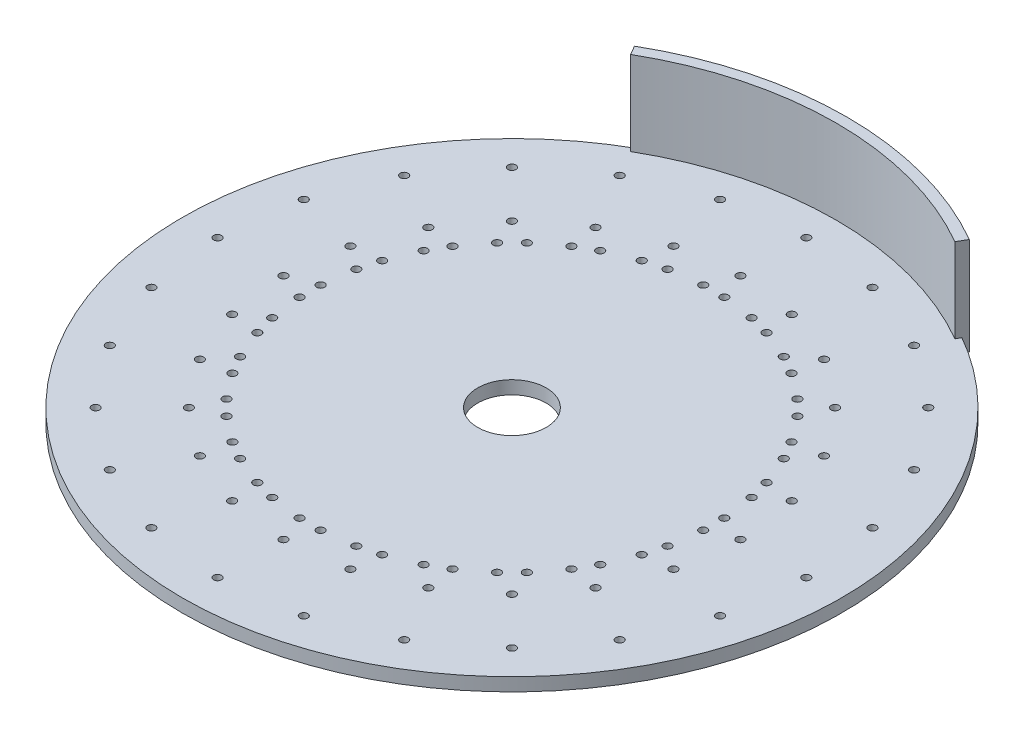
from build123d import *

# Parameters (mm, degrees)
SKETCH1_R                = 125
SKETCH1_R_2              = 1.5
SKETCH1_R_3              = 13
BOSS_EXTRUDE1_DEPTH      = 2.5
BOSS_EXTRUDE2_DEPTH      = 32
BOSS_EXTRUDE2_DEPTH_BACK = 5
BOSS_EXTRUDE3_START      = 32
BOSS_EXTRUDE3_DEPTH      = 31.9


with BuildPart() as part:
    # Sketch1 → Boss-Extrude1 (new, symmetric)
    with BuildSketch(Plane(origin=(0, 0, 0), x_dir=(1, 0, 0), z_dir=(0, 1, 0))):
        with Locations(Location((0, 0, 0), (0, 0, 270))):
            Circle(SKETCH1_R)
        with Locations(Location((-4, 76.547549861, 0), (0, 0, 270))):
            Circle(SKETCH1_R_2, mode=Mode.SUBTRACT)
        with Locations(Location((4, 76.547549861, 0), (0, 0, 90))):
            Circle(SKETCH1_R_2, mode=Mode.SUBTRACT)
        with Locations(Location((15.948260455, 74.97453153, 0), (0, 0, 270))):
            Circle(SKETCH1_R_2, mode=Mode.SUBTRACT)
        with Locations(Location((23.675667065, 72.903979169, 0), (0, 0, 90))):
            Circle(SKETCH1_R_2, mode=Mode.SUBTRACT)
        with Locations(Location((34.809673315, 68.292122777, 0), (0, 0, 270))):
            Circle(SKETCH1_R_2, mode=Mode.SUBTRACT)
        with Locations(Location((41.737876545, 64.292122777, 0), (0, 0, 90))):
            Circle(SKETCH1_R_2, mode=Mode.SUBTRACT)
        with Locations(Location((51.298864465, 56.955718714, 0), (0, 0, 270))):
            Circle(SKETCH1_R_2, mode=Mode.SUBTRACT)
        with Locations(Location((56.955718714, 51.298864465, 0), (0, 0, 90))):
            Circle(SKETCH1_R_2, mode=Mode.SUBTRACT)
        with Locations(Location((64.292122777, 41.737876545, 0), (0, 0, 270))):
            Circle(SKETCH1_R_2, mode=Mode.SUBTRACT)
        with Locations(Location((68.292122777, 34.809673315, 0), (0, 0, 90))):
            Circle(SKETCH1_R_2, mode=Mode.SUBTRACT)
        with Locations(Location((72.903979169, 23.675667065, 0), (0, 0, 270))):
            Circle(SKETCH1_R_2, mode=Mode.SUBTRACT)
        with Locations(Location((74.97453153, 15.948260455, 0), (0, 0, 90))):
            Circle(SKETCH1_R_2, mode=Mode.SUBTRACT)
        with Locations(Location((76.547549861, 4, 0), (0, 0, 270))):
            Circle(SKETCH1_R_2, mode=Mode.SUBTRACT)
        with Locations(Location((76.547549861, -4, 0), (0, 0, 90))):
            Circle(SKETCH1_R_2, mode=Mode.SUBTRACT)
        with Locations(Location((74.97453153, -15.948260455, 0), (0, 0, 270))):
            Circle(SKETCH1_R_2, mode=Mode.SUBTRACT)
        with Locations(Location((72.903979169, -23.675667065, 0), (0, 0, 90))):
            Circle(SKETCH1_R_2, mode=Mode.SUBTRACT)
        with Locations(Location((68.292122777, -34.809673315, 0), (0, 0, 270))):
            Circle(SKETCH1_R_2, mode=Mode.SUBTRACT)
        with Locations(Location((64.292122777, -41.737876545, 0), (0, 0, 90))):
            Circle(SKETCH1_R_2, mode=Mode.SUBTRACT)
        with Locations(Location((56.955718714, -51.298864465, 0), (0, 0, 270))):
            Circle(SKETCH1_R_2, mode=Mode.SUBTRACT)
        with Locations(Location((51.298864465, -56.955718714, 0), (0, 0, 90))):
            Circle(SKETCH1_R_2, mode=Mode.SUBTRACT)
        with Locations(Location((41.737876545, -64.292122777, 0), (0, 0, 270))):
            Circle(SKETCH1_R_2, mode=Mode.SUBTRACT)
        with Locations(Location((34.809673315, -68.292122777, 0), (0, 0, 90))):
            Circle(SKETCH1_R_2, mode=Mode.SUBTRACT)
        with Locations(Location((23.675667065, -72.903979169, 0), (0, 0, 270))):
            Circle(SKETCH1_R_2, mode=Mode.SUBTRACT)
        with Locations(Location((15.948260455, -74.97453153, 0), (0, 0, 90))):
            Circle(SKETCH1_R_2, mode=Mode.SUBTRACT)
        with Locations(Location((4, -76.547549861, 0), (0, 0, 270))):
            Circle(SKETCH1_R_2, mode=Mode.SUBTRACT)
        with Locations(Location((-4, -76.547549861, 0), (0, 0, 90))):
            Circle(SKETCH1_R_2, mode=Mode.SUBTRACT)
        with Locations(Location((-15.948260455, -74.97453153, 0), (0, 0, 270))):
            Circle(SKETCH1_R_2, mode=Mode.SUBTRACT)
        with Locations(Location((-23.675667065, -72.903979169, 0), (0, 0, 90))):
            Circle(SKETCH1_R_2, mode=Mode.SUBTRACT)
        with Locations(Location((-34.809673315, -68.292122777, 0), (0, 0, 270))):
            Circle(SKETCH1_R_2, mode=Mode.SUBTRACT)
        with Locations(Location((-41.737876545, -64.292122777, 0), (0, 0, 90))):
            Circle(SKETCH1_R_2, mode=Mode.SUBTRACT)
        with Locations(Location((-51.298864465, -56.955718714, 0), (0, 0, 270))):
            Circle(SKETCH1_R_2, mode=Mode.SUBTRACT)
        with Locations(Location((-56.955718714, -51.298864465, 0), (0, 0, 90))):
            Circle(SKETCH1_R_2, mode=Mode.SUBTRACT)
        with Locations(Location((-64.292122777, -41.737876545, 0), (0, 0, 270))):
            Circle(SKETCH1_R_2, mode=Mode.SUBTRACT)
        with Locations(Location((-68.292122777, -34.809673315, 0), (0, 0, 90))):
            Circle(SKETCH1_R_2, mode=Mode.SUBTRACT)
        with Locations(Location((-72.903979169, -23.675667065, 0), (0, 0, 270))):
            Circle(SKETCH1_R_2, mode=Mode.SUBTRACT)
        with Locations(Location((-74.97453153, -15.948260455, 0), (0, 0, 90))):
            Circle(SKETCH1_R_2, mode=Mode.SUBTRACT)
        with Locations(Location((-76.54754986, -4, 0), (0, 0, 270))):
            Circle(SKETCH1_R_2, mode=Mode.SUBTRACT)
        with Locations(Location((-76.54754986, 4, 0), (0, 0, 90))):
            Circle(SKETCH1_R_2, mode=Mode.SUBTRACT)
        with Locations(Location((-74.97453153, 15.948260455, 0), (0, 0, 270))):
            Circle(SKETCH1_R_2, mode=Mode.SUBTRACT)
        with Locations(Location((-72.903979169, 23.675667065, 0), (0, 0, 90))):
            Circle(SKETCH1_R_2, mode=Mode.SUBTRACT)
        with Locations(Location((-68.292122777, 34.809673315, 0), (0, 0, 270))):
            Circle(SKETCH1_R_2, mode=Mode.SUBTRACT)
        with Locations(Location((-64.292122777, 41.737876545, 0), (0, 0, 90))):
            Circle(SKETCH1_R_2, mode=Mode.SUBTRACT)
        with Locations(Location((-56.955718714, 51.298864465, 0), (0, 0, 270))):
            Circle(SKETCH1_R_2, mode=Mode.SUBTRACT)
        with Locations(Location((-51.298864465, 56.955718714, 0), (0, 0, 90))):
            Circle(SKETCH1_R_2, mode=Mode.SUBTRACT)
        with Locations(Location((-41.737876545, 64.292122777, 0), (0, 0, 270))):
            Circle(SKETCH1_R_2, mode=Mode.SUBTRACT)
        with Locations(Location((-34.809673315, 68.292122777, 0), (0, 0, 90))):
            Circle(SKETCH1_R_2, mode=Mode.SUBTRACT)
        with Locations(Location((-23.675667065, 72.903979169, 0), (0, 0, 270))):
            Circle(SKETCH1_R_2, mode=Mode.SUBTRACT)
        with Locations(Location((-15.948260455, 74.97453153, 0), (0, 0, 90))):
            Circle(SKETCH1_R_2, mode=Mode.SUBTRACT)
        with Locations(Location((0, 0, 0), (0, 0, 270))):
            Circle(SKETCH1_R_3, mode=Mode.SUBTRACT)
        with Locations(Location((86.65, 0, 0), (0, 0, 270))):
            Circle(SKETCH1_R_2, mode=Mode.SUBTRACT)
        with Locations(Location((111.65, 0, 0), (0, 0, 270))):
            Circle(SKETCH1_R_2, mode=Mode.SUBTRACT)
        with Locations(Location((107.845618505, -28.897146386, 0), (0, 0, 270))):
            Circle(SKETCH1_R_2, mode=Mode.SUBTRACT)
        with Locations(Location((96.691736333, -55.825, 0), (0, 0, 270))):
            Circle(SKETCH1_R_2, mode=Mode.SUBTRACT)
        with Locations(Location((78.948472119, -78.948472119, 0), (0, 0, 270))):
            Circle(SKETCH1_R_2, mode=Mode.SUBTRACT)
        with Locations(Location((55.825, -96.691736333, 0), (0, 0, 270))):
            Circle(SKETCH1_R_2, mode=Mode.SUBTRACT)
        with Locations(Location((28.897146386, -107.845618505, 0), (0, 0, 270))):
            Circle(SKETCH1_R_2, mode=Mode.SUBTRACT)
        with Locations(Location((0, -111.65, 0), (0, 0, 270))):
            Circle(SKETCH1_R_2, mode=Mode.SUBTRACT)
        with Locations(Location((-28.897146386, -107.845618505, 0), (0, 0, 270))):
            Circle(SKETCH1_R_2, mode=Mode.SUBTRACT)
        with Locations(Location((-55.825, -96.691736333, 0), (0, 0, 270))):
            Circle(SKETCH1_R_2, mode=Mode.SUBTRACT)
        with Locations(Location((-78.948472119, -78.948472119, 0), (0, 0, 270))):
            Circle(SKETCH1_R_2, mode=Mode.SUBTRACT)
        with Locations(Location((-96.691736333, -55.825, 0), (0, 0, 270))):
            Circle(SKETCH1_R_2, mode=Mode.SUBTRACT)
        with Locations(Location((-107.845618505, -28.897146386, 0), (0, 0, 270))):
            Circle(SKETCH1_R_2, mode=Mode.SUBTRACT)
        with Locations(Location((-111.65, 0, 0), (0, 0, 270))):
            Circle(SKETCH1_R_2, mode=Mode.SUBTRACT)
        with Locations(Location((-107.845618505, 28.897146386, 0), (0, 0, 270))):
            Circle(SKETCH1_R_2, mode=Mode.SUBTRACT)
        with Locations(Location((-96.691736333, 55.825, 0), (0, 0, 270))):
            Circle(SKETCH1_R_2, mode=Mode.SUBTRACT)
        with Locations(Location((-78.948472119, 78.948472119, 0), (0, 0, 270))):
            Circle(SKETCH1_R_2, mode=Mode.SUBTRACT)
        with Locations(Location((-55.825, 96.691736333, 0), (0, 0, 270))):
            Circle(SKETCH1_R_2, mode=Mode.SUBTRACT)
        with Locations(Location((-28.897146386, 107.845618505, 0), (0, 0, 270))):
            Circle(SKETCH1_R_2, mode=Mode.SUBTRACT)
        with Locations(Location((0, 111.65, 0), (0, 0, 270))):
            Circle(SKETCH1_R_2, mode=Mode.SUBTRACT)
        with Locations(Location((28.897146386, 107.845618505, 0), (0, 0, 270))):
            Circle(SKETCH1_R_2, mode=Mode.SUBTRACT)
        with Locations(Location((55.825, 96.691736333, 0), (0, 0, 270))):
            Circle(SKETCH1_R_2, mode=Mode.SUBTRACT)
        with Locations(Location((78.948472119, 78.948472119, 0), (0, 0, 270))):
            Circle(SKETCH1_R_2, mode=Mode.SUBTRACT)
        with Locations(Location((96.691736333, 55.825, 0), (0, 0, 270))):
            Circle(SKETCH1_R_2, mode=Mode.SUBTRACT)
        with Locations(Location((107.845618505, 28.897146386, 0), (0, 0, 270))):
            Circle(SKETCH1_R_2, mode=Mode.SUBTRACT)
        with Locations(Location((83.697472848, -22.426670258, 0), (0, 0, 270))):
            Circle(SKETCH1_R_2, mode=Mode.SUBTRACT)
        with Locations(Location((75.041101238, -43.325, 0), (0, 0, 270))):
            Circle(SKETCH1_R_2, mode=Mode.SUBTRACT)
        with Locations(Location((61.27080259, -61.27080259, 0), (0, 0, 270))):
            Circle(SKETCH1_R_2, mode=Mode.SUBTRACT)
        with Locations(Location((43.325, -75.041101238, 0), (0, 0, 270))):
            Circle(SKETCH1_R_2, mode=Mode.SUBTRACT)
        with Locations(Location((22.426670258, -83.697472848, 0), (0, 0, 270))):
            Circle(SKETCH1_R_2, mode=Mode.SUBTRACT)
        with Locations(Location((0, -86.65, 0), (0, 0, 270))):
            Circle(SKETCH1_R_2, mode=Mode.SUBTRACT)
        with Locations(Location((-22.426670258, -83.697472848, 0), (0, 0, 270))):
            Circle(SKETCH1_R_2, mode=Mode.SUBTRACT)
        with Locations(Location((-43.325, -75.041101238, 0), (0, 0, 270))):
            Circle(SKETCH1_R_2, mode=Mode.SUBTRACT)
        with Locations(Location((-61.27080259, -61.27080259, 0), (0, 0, 270))):
            Circle(SKETCH1_R_2, mode=Mode.SUBTRACT)
        with Locations(Location((-75.041101238, -43.325, 0), (0, 0, 270))):
            Circle(SKETCH1_R_2, mode=Mode.SUBTRACT)
        with Locations(Location((-83.697472848, -22.426670258, 0), (0, 0, 270))):
            Circle(SKETCH1_R_2, mode=Mode.SUBTRACT)
        with Locations(Location((-86.65, 0, 0), (0, 0, 270))):
            Circle(SKETCH1_R_2, mode=Mode.SUBTRACT)
        with Locations(Location((-83.697472848, 22.426670258, 0), (0, 0, 270))):
            Circle(SKETCH1_R_2, mode=Mode.SUBTRACT)
        with Locations(Location((-75.041101238, 43.325, 0), (0, 0, 270))):
            Circle(SKETCH1_R_2, mode=Mode.SUBTRACT)
        with Locations(Location((-61.27080259, 61.27080259, 0), (0, 0, 270))):
            Circle(SKETCH1_R_2, mode=Mode.SUBTRACT)
        with Locations(Location((-43.325, 75.041101238, 0), (0, 0, 270))):
            Circle(SKETCH1_R_2, mode=Mode.SUBTRACT)
        with Locations(Location((-22.426670258, 83.697472848, 0), (0, 0, 270))):
            Circle(SKETCH1_R_2, mode=Mode.SUBTRACT)
        with Locations(Location((0, 86.65, 0), (0, 0, 270))):
            Circle(SKETCH1_R_2, mode=Mode.SUBTRACT)
        with Locations(Location((22.426670258, 83.697472848, 0), (0, 0, 270))):
            Circle(SKETCH1_R_2, mode=Mode.SUBTRACT)
        with Locations(Location((43.325, 75.041101238, 0), (0, 0, 270))):
            Circle(SKETCH1_R_2, mode=Mode.SUBTRACT)
        with Locations(Location((61.27080259, 61.27080259, 0), (0, 0, 270))):
            Circle(SKETCH1_R_2, mode=Mode.SUBTRACT)
        with Locations(Location((75.041101238, 43.325, 0), (0, 0, 270))):
            Circle(SKETCH1_R_2, mode=Mode.SUBTRACT)
        with Locations(Location((83.697472848, 22.426670258, 0), (0, 0, 270))):
            Circle(SKETCH1_R_2, mode=Mode.SUBTRACT)
    extrude(amount=BOSS_EXTRUDE1_DEPTH, both=True)


with BuildPart() as body_2:
    # Sketch2 → Boss-Extrude2 (new, two sides: drawn at the far end of the back side and taken through both)
    with BuildSketch(Plane(origin=(0, 2.5, 0), x_dir=(1, 0, 0), z_dir=(0, 1, 0)).offset(-BOSS_EXTRUDE2_DEPTH_BACK)):
        with BuildLine():
            ThreePointArc((63.5, 109.985226281), (0, 127), (-63.5, 109.985226281))
            Line((-63.5, 109.985226281), (-62.5, 108.253175473))
            ThreePointArc((-62.5, 108.253175473), (0, 125), (62.5, 108.253175473))
            Line((62.5, 108.253175473), (63.5, 109.985226281))
        make_face()
    extrude(amount=BOSS_EXTRUDE2_DEPTH + BOSS_EXTRUDE2_DEPTH_BACK)

    # Sketch2<3> → Boss-Extrude3 (add)
    with BuildSketch(Plane(origin=(0, 2.5, 0), x_dir=(1, 0, 0), z_dir=(0, 1, 0)).offset(BOSS_EXTRUDE3_START)):
        with BuildLine():
            ThreePointArc((62.5, 108.253175473), (0, 125), (-62.5, 108.253175473))
            Line((-62.5, 108.253175473), (-61.5, 106.521124665))
            ThreePointArc((-61.5, 106.521124665), (0, 123), (61.5, 106.521124665))
            Line((61.5, 106.521124665), (62.5, 108.253175473))
        make_face()
    extrude(amount=-BOSS_EXTRUDE3_DEPTH)


solid = Compound([part.part, body_2.part])
